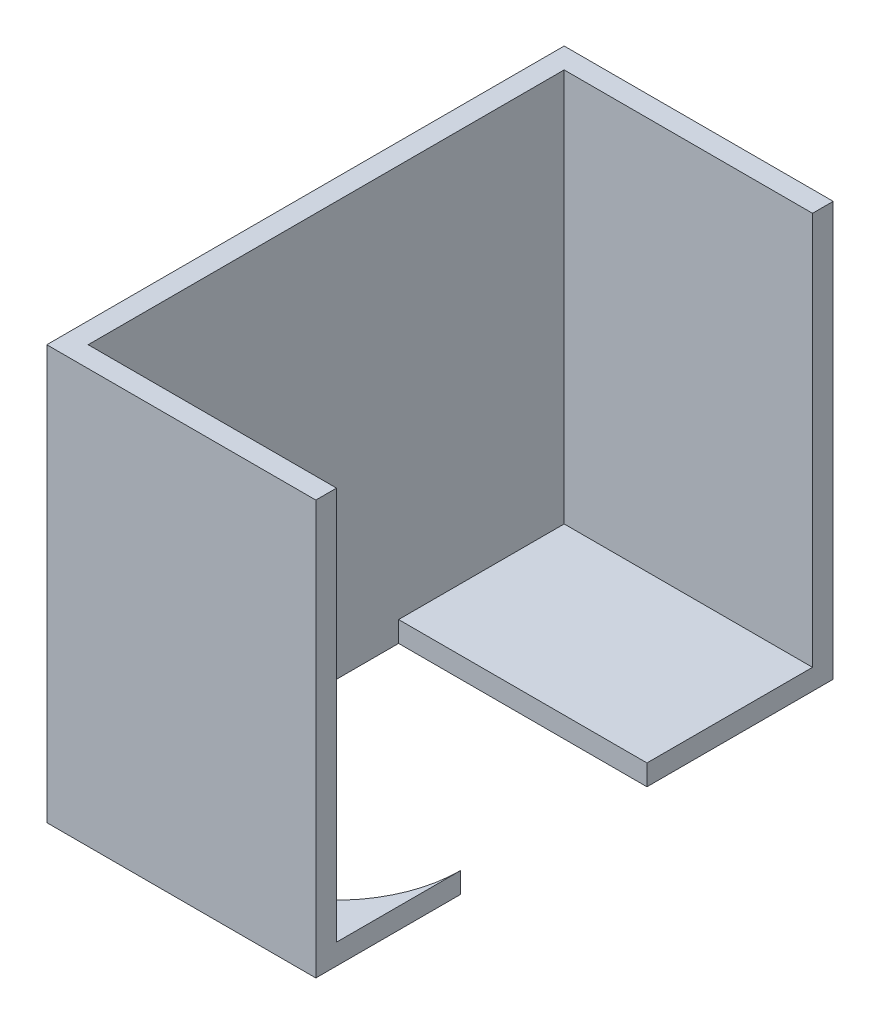
from build123d import *

# Parameters (mm, degrees)
SKETCH_15_W          = 13
SKETCH_15_H          = 25
EXTRUDE_4_DEPTH      = 20
CUT_EXTRUDE_START    = 1
SKETCH_16_W          = 12
SKETCH_16_H          = 23
CUT_EXTRUDE_47_DEPTH = 24.6018292
CUT_EXTRUDE_48_DEPTH = 25.6018292


with BuildPart() as part:
    # 스케치15 → 보스-돌출4 (new body)
    with BuildSketch(Plane(origin=(0, 0, 0), x_dir=(1, 0, 0), z_dir=(0, 1, 0))):
        with Locations((0.5, 0)):
            Rectangle(SKETCH_15_W, SKETCH_15_H)
    extrude(amount=EXTRUDE_4_DEPTH)

    # 스케치16 → 컷-돌출47 (cut, through all)
    with BuildSketch(Plane(origin=(0, 0, 0), x_dir=(1, 0, 0), z_dir=(0, 1, 0)).offset(CUT_EXTRUDE_START)):
        with Locations((1, 0)):
            Rectangle(SKETCH_16_W, SKETCH_16_H)
    extrude(amount=CUT_EXTRUDE_47_DEPTH, mode=Mode.SUBTRACT)

    # 스케치17 → 컷-돌출48 (cut, through all)
    with BuildSketch(Plane(origin=(0, 0, 0), x_dir=(1, 0, 0), z_dir=(0, 1, 0))):
        with BuildLine():
            Line((-5, 3.5), (7, 3.5))
            Line((7, 3.5), (7, -5.5))
            ThreePointArc((7, -5.5), (1, -11.5), (-5, -5.5))
            Line((-5, -5.5), (-5, 3.5))
        make_face()
    extrude(amount=CUT_EXTRUDE_48_DEPTH, mode=Mode.SUBTRACT)


solid = part.part
